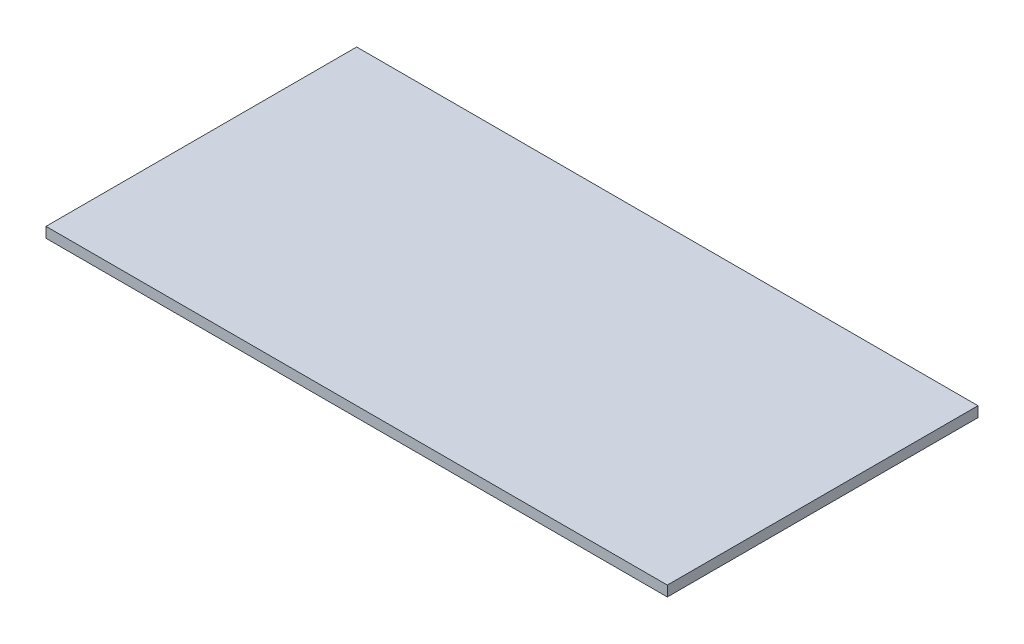
from build123d import *

# Parameters (mm, degrees)
SZKIC1_W                    = 600
SZKIC1_H                    = 300
DODANIE_WYCI_GNI_CIE1_DEPTH = 10


with BuildPart() as part:
    # Szkic1 → Dodanie-wyciągnięcie1 (new body)
    with BuildSketch(Plane(origin=(0, 0, 0), x_dir=(1, 0, 0), z_dir=(0, 1, 0))):
        with Locations((300, 150)):
            Rectangle(SZKIC1_W, SZKIC1_H)
    extrude(amount=DODANIE_WYCI_GNI_CIE1_DEPTH)


solid = part.part
